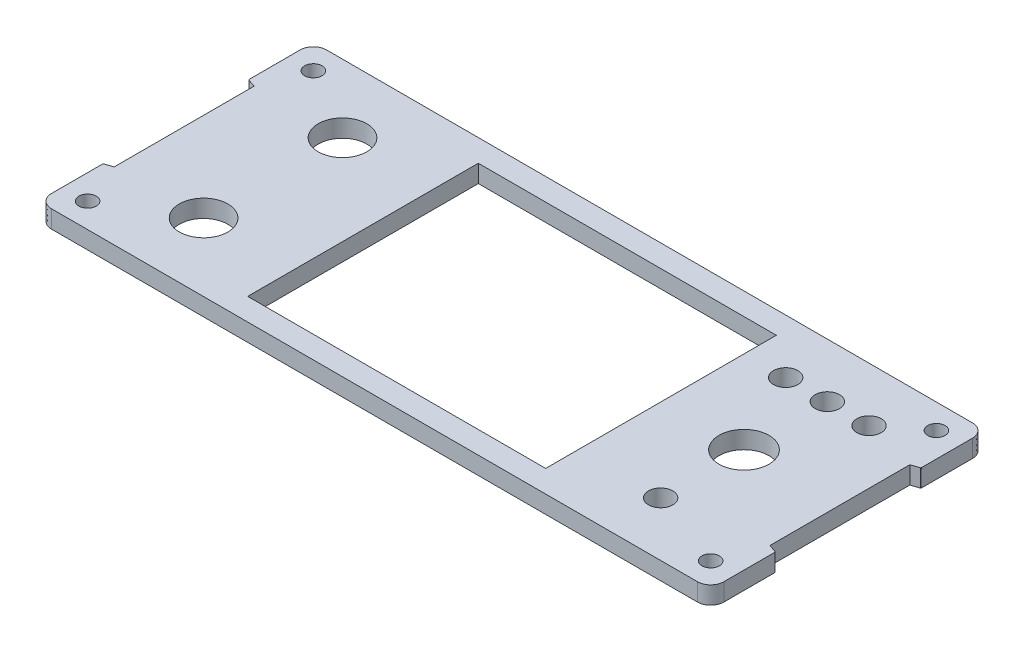
from build123d import *

# Parameters (mm, degrees)
SKETCH_1_R      = 3.5
SKETCH_1_R_2    = 3.6
SKETCH_1_R_3    = 1.249999971
SKETCH_1_R_4    = 1.75
SKETCH_1_W      = 42.9
SKETCH_1_H      = 33.2
EXTRUDE_1_DEPTH = 2.54


with BuildPart() as part:
    # 草图1 → 凸台-拉伸1 (new body)
    with BuildSketch(Plane(origin=(0, 0, 0), x_dir=(1, 0, 0), z_dir=(0, 1, 0))):
        with BuildLine():
            Line((48.4, -37.799999853), (48.4, -30.444151853))
            add(Edge.make_bspline(
                [(48.4, -30.444151853), (48.4, -30.412185559), (48.381122931, -30.385679038), (48.362542068, -30.359588441), (48.331618599, -30.349282131)],
                knots=[0, 0, 0, 0.5, 0.5, 1, 1, 1], degree=2))
            Line((48.331618599, -30.349282131), (47.2, -29.972075797))
            Line((47.2, -29.972075797), (47.2, -9.827924497))
            Line((47.2, -9.827924497), (48.331621786, -9.450717896))
            add(Edge.make_bspline(
                [(48.331621786, -9.450717896), (48.361949426, -9.440608674), (48.381126465, -9.414316076), (48.400002612, -9.388436014), (48.399998982, -9.35583844)],
                knots=[0, 0, 0, 0.5, 0.5, 1, 1, 1], degree=2))
            Line((48.399998982, -9.35583844), (48.399998982, -2.000000147))
            add(Edge.make_bspline(
                [(48.399998982, -2.000000147), (48.399998982, -1.622352729), (48.255370094, -1.272901625), (48.11105262, -0.924202959), (47.843501866, -0.656497263), (47.576728704, -0.389569608), (47.227097503, -0.244629035), (46.878218161, -0.100000147), (46.499998982, -0.100000147)],
                knots=[0, 0, 0, 0.25, 0.25, 0.5, 0.5, 0.75, 0.75, 1, 1, 1], degree=2))
            Line((46.499998982, -0.100000147), (-46.499999902, -0.100000147))
            add(Edge.make_bspline(
                [(-46.499999902, -0.100000147), (-46.87764732, -0.100000147), (-47.227098424, -0.244629035), (-47.575797089, -0.388946508), (-47.843502786, -0.656497263), (-48.110430441, -0.923270425), (-48.255371014, -1.272901625), (-48.399999902, -1.621780968), (-48.399999902, -2.000000147)],
                knots=[0, 0, 0, 0.25, 0.25, 0.5, 0.5, 0.75, 0.75, 1, 1, 1], degree=2))
            Line((-48.399999902, -2.000000147), (-48.399999902, -9.355848147))
            add(Edge.make_bspline(
                [(-48.399999902, -9.355848147), (-48.399999902, -9.387814441), (-48.381122833, -9.414320961), (-48.362541971, -9.440411559), (-48.331618501, -9.450717869)],
                knots=[0, 0, 0, 0.5, 0.5, 1, 1, 1], degree=2))
            Line((-48.331618501, -9.450717869), (-47.199999902, -9.827924203))
            Line((-47.199999902, -9.827924203), (-47.199999902, -29.97207609))
            Line((-47.199999902, -29.97207609), (-48.331620003, -30.349282599))
            add(Edge.make_bspline(
                [(-48.331620003, -30.349282599), (-48.361947916, -30.359391659), (-48.381125177, -30.385684352), (-48.400001544, -30.411564511), (-48.399997915, -30.444162293)],
                knots=[0, 0, 0, 0.5, 0.5, 1, 1, 1], degree=2))
            Line((-48.399997915, -30.444162293), (-48.4, -37.799999853))
            add(Edge.make_bspline(
                [(-48.4, -37.799999853), (-48.4, -38.177647271), (-48.255371112, -38.527098375), (-48.111053639, -38.875797041), (-47.843502884, -39.143502737), (-47.576729722, -39.410430392), (-47.227098521, -39.555370965), (-46.878219179, -39.699999853), (-46.5, -39.699999853)],
                knots=[0, 0, 0, 0.25, 0.25, 0.5, 0.5, 0.75, 0.75, 1, 1, 1], degree=2))
            Line((-46.5, -39.699999853), (46.5, -39.699999853))
            add(Edge.make_bspline(
                [(46.5, -39.699999853), (46.877647417, -39.699999853), (47.227098521, -39.555370965), (47.575797187, -39.411053492), (47.843502884, -39.143502737), (48.110430539, -38.876729575), (48.255371112, -38.527098375), (48.4, -38.178219032), (48.4, -37.799999853)],
                knots=[0, 0, 0, 0.25, 0.25, 0.5, 0.5, 0.75, 0.75, 1, 1, 1], degree=2))
        make_face()
        with Locations(Location((-34.399999902, -9.900000147, 0), (0, 0, 270))):
            Circle(SKETCH_1_R, mode=Mode.SUBTRACT)
        with Locations(Location((-34.399999902, -29.900000147, 0), (0, 0, 270))):
            Circle(SKETCH_1_R, mode=Mode.SUBTRACT)
        with Locations(Location((33.399998982, -19.9, 0), (0, 0, 270))):
            Circle(SKETCH_1_R_2, mode=Mode.SUBTRACT)
        with Locations(Location((-44.85, -36.15, 0), (0, 0, 270))):
            Circle(SKETCH_1_R_3, mode=Mode.SUBTRACT)
        with Locations(Location((44.85, -36.15, 0), (0, 0, 270))):
            Circle(SKETCH_1_R_3, mode=Mode.SUBTRACT)
        with Locations(Location((27.399998982, -7.899999853, 0), (0, 0, 270))):
            Circle(SKETCH_1_R_4, mode=Mode.SUBTRACT)
        with Locations(Location((-44.85, -3.65, 0), (0, 0, 270))):
            Circle(SKETCH_1_R_3, mode=Mode.SUBTRACT)
        with Locations(Location((44.85, -3.65, 0), (0, 0, 270))):
            Circle(SKETCH_1_R_3, mode=Mode.SUBTRACT)
        with Locations(Location((39.399998982, -7.899999853, 0), (0, 0, 270))):
            Circle(SKETCH_1_R_4, mode=Mode.SUBTRACT)
        with Locations(Location((33.399998982, -31.90000044, 0), (0, 0, 270))):
            Circle(SKETCH_1_R_4, mode=Mode.SUBTRACT)
        with Locations(Location((33.399998982, -7.899999853, 0), (0, 0, 270))):
            Circle(SKETCH_1_R_4, mode=Mode.SUBTRACT)
        with Locations((0, -19.900000147)):
            Rectangle(SKETCH_1_W, SKETCH_1_H, mode=Mode.SUBTRACT)
    extrude(amount=EXTRUDE_1_DEPTH)


solid = part.part
